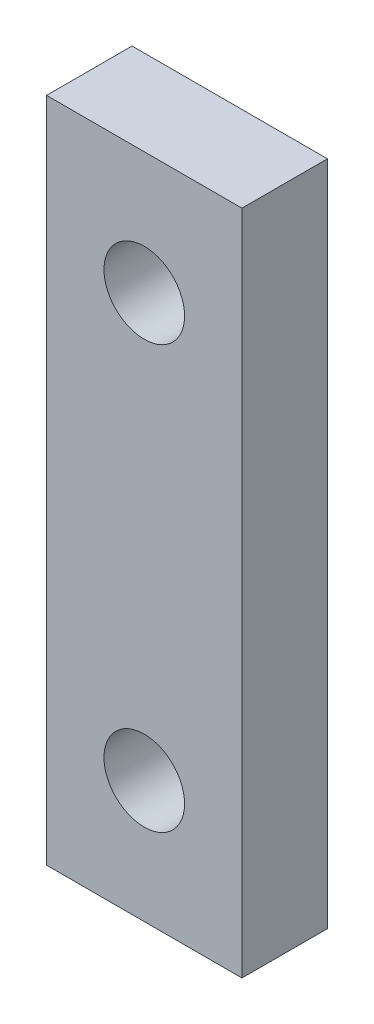
from build123d import *

# Parameters (mm, degrees)
SKETCH1_W           = 8
SKETCH1_H           = 27.3
SKETCH1_R           = 1.65
BOSS_EXTRUDE1_DEPTH = 3.5


with BuildPart() as part:
    # Sketch1 → Boss-Extrude1 (new body)
    with BuildSketch(Plane.XY):
        with Locations((4, 13.65)):
            Rectangle(SKETCH1_W, SKETCH1_H)
        with Locations((4, 22.3)):
            Circle(SKETCH1_R, mode=Mode.SUBTRACT)
        with Locations((4, 5)):
            Circle(SKETCH1_R, mode=Mode.SUBTRACT)
    extrude(amount=BOSS_EXTRUDE1_DEPTH)


solid = part.part
